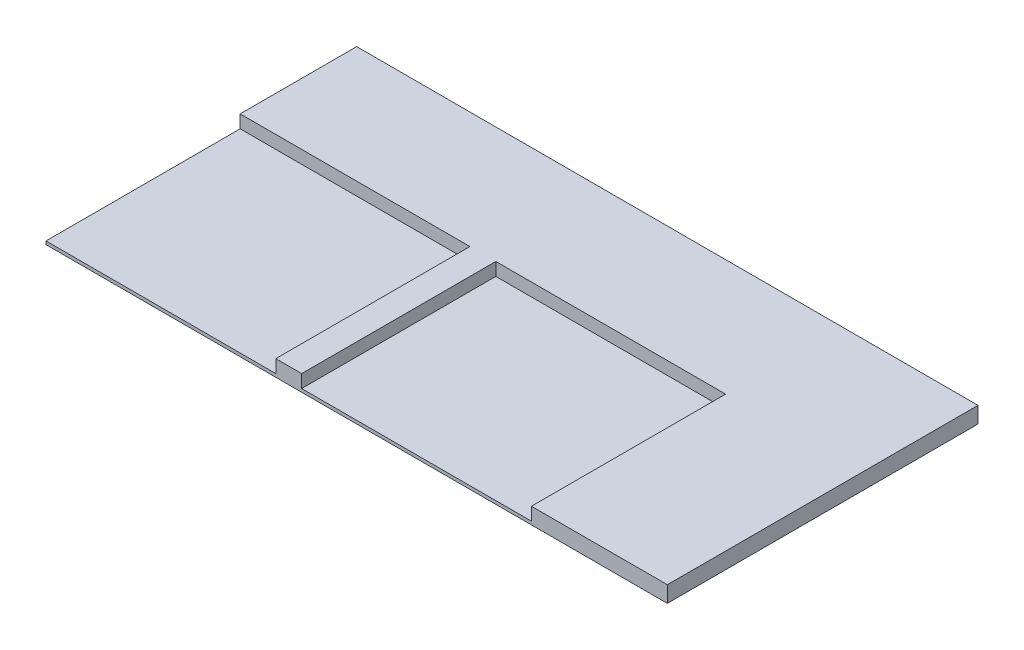
from build123d import *

# Parameters (mm, degrees)
SKETCH1_W           = 1219.2
SKETCH1_H           = 609.6
BOSS_EXTRUDE1_DEPTH = 6.35
SKETCH7_W           = 266.7
SKETCH7_H           = 381
SKETCH7_W_2         = 50.8
BOSS_EXTRUDE2_DEPTH = 25.4


with BuildPart() as part:
    # Sketch1 → Boss-Extrude1 (new body)
    with BuildSketch(Plane(origin=(0, 0, 0), x_dir=(1, 0, 0), z_dir=(0, 1, 0))):
        with Locations((609.6, 304.8)):
            Rectangle(SKETCH1_W, SKETCH1_H)
    extrude(amount=BOSS_EXTRUDE1_DEPTH)

    # Sketch7 → Boss-Extrude2 (add)
    with BuildSketch(Plane(origin=(0, 6.35, 0), x_dir=(1, 0, 0), z_dir=(0, 1, 0))):
        Polygon((1219.2, 609.6), (0, 609.6), (0, 381), (450.85, 381), (501.65, 381), (952.5, 381), (1219.2, 381), align=None)
        with Locations((1085.85, 190.5)):
            Rectangle(SKETCH7_W, SKETCH7_H)
        with Locations((476.25, 190.5)):
            Rectangle(SKETCH7_W_2, SKETCH7_H)
    extrude(amount=BOSS_EXTRUDE2_DEPTH)


solid = part.part
